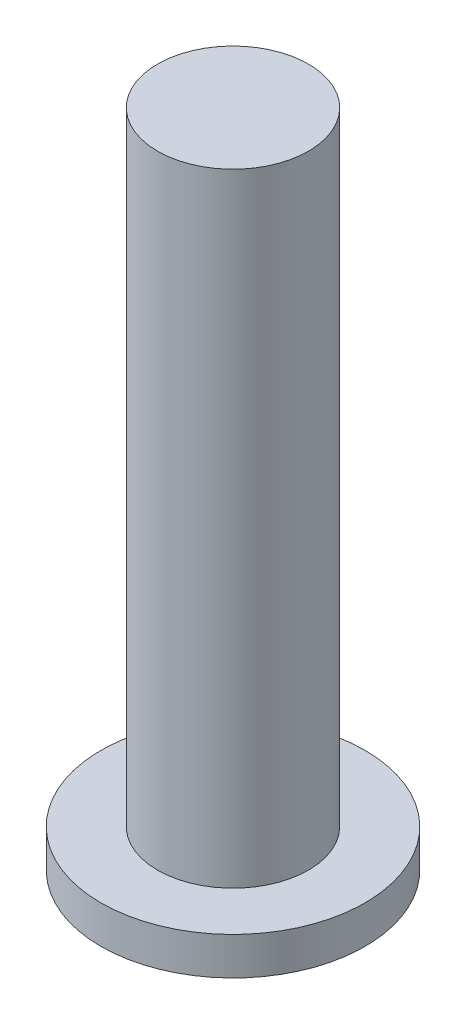
from build123d import *

# Parameters (mm, degrees)
ESQUISSE1_R        = 7
ESQUISSE1_R_2      = 4
BOSS_EXTRU_1_DEPTH = 2
ESQUISSE1_4_R      = 4
BOSS_EXTRU_3_DEPTH = 35


with BuildPart() as part:
    # Esquisse1 → Boss.-Extru.1 (new body)
    with BuildSketch(Plane(origin=(0, 0, 0), x_dir=(1, 0, 0), z_dir=(0, 1, 0))):
        Circle(ESQUISSE1_R)
        Circle(ESQUISSE1_R_2, mode=Mode.SUBTRACT)
    extrude(amount=BOSS_EXTRU_1_DEPTH)

    # Esquisse1<4> → Boss.-Extru.3 (add)
    with BuildSketch(Plane(origin=(0, 0, 0), x_dir=(1, 0, 0), z_dir=(0, 1, 0))):
        Circle(ESQUISSE1_4_R)
    extrude(amount=BOSS_EXTRU_3_DEPTH)


solid = part.part
